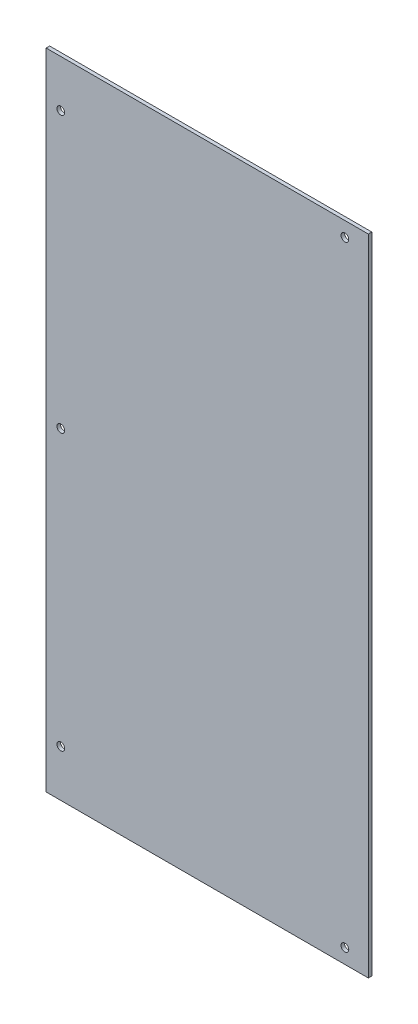
from build123d import *

# Parameters (mm, degrees)
SKETCH1_W            = 275
SKETCH1_H            = 550
BOSS_EXTRUDE1_DEPTH  = 3
M6_CLEARANCE_HOLE1_D = 6.6


with BuildPart() as part:
    # Sketch1 → Boss-Extrude1 (new body)
    with BuildSketch(Plane.XY):
        with Locations((137.5, 275)):
            Rectangle(SKETCH1_W, SKETCH1_H)
    extrude(amount=BOSS_EXTRUDE1_DEPTH)

    # M6 Clearance Hole1 (through all)
    with Locations(Plane.XY.offset(3)):
        with Locations((12.5, 275), (12.5, 510), (12.5, 40), (255, 12.5), (255, 537.5)):
            Hole(M6_CLEARANCE_HOLE1_D / 2)


solid = part.part
